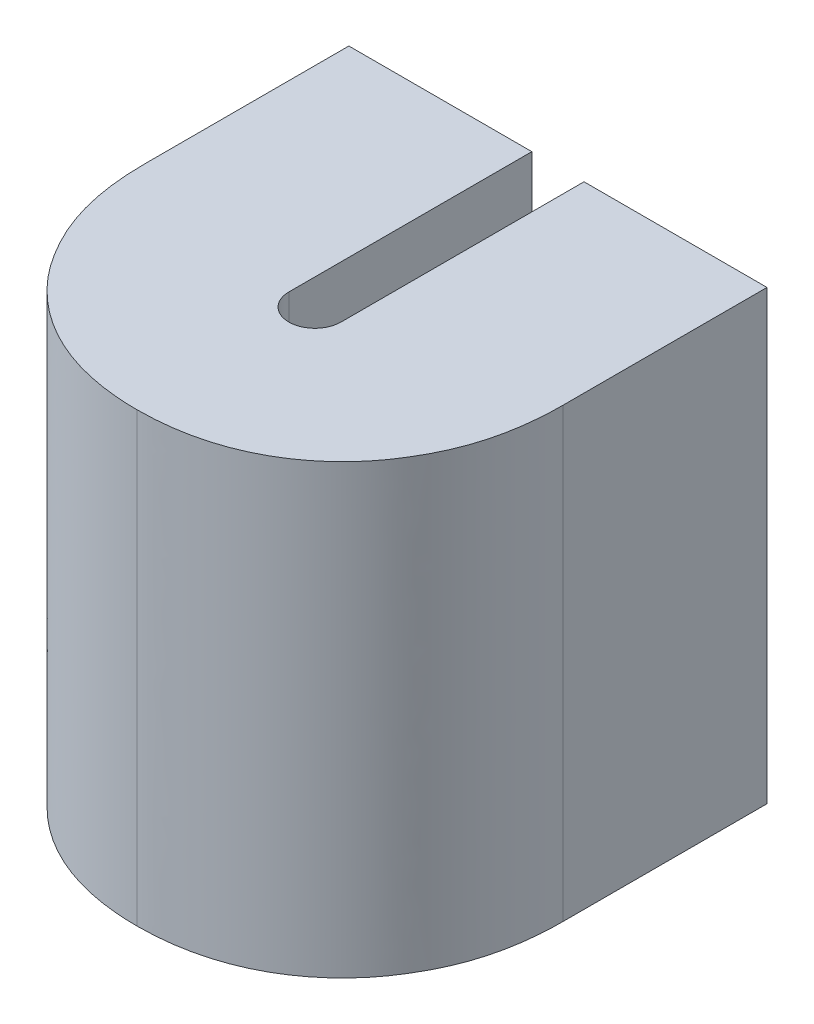
from build123d import *

# Parameters (mm, degrees)
BOSS_EXTRUDE1_DEPTH = 1500


with BuildPart() as part:
    # Sketch1 → Boss-Extrude1 (new body)
    with BuildSketch(Plane(origin=(0, 0, 0), x_dir=(1, 0, 0), z_dir=(0, 1, 0))):
        with BuildLine():
            Line((701.336933058, 727.73340936), (701.336933058, 1412))
            Line((701.336933058, 1412), (87.5, 1412))
            Line((87.5, 1412), (87.5, 596.839793384))
            ThreePointArc((87.5, 596.839793384), (0, 509.339793384), (-87.5, 596.839793384))
            Line((-87.5, 596.839793384), (-87.5, 1412))
            Line((-87.5, 1412), (-701.336933058, 1412))
            Line((-701.336933058, 1412), (-701.336933058, 727.73340936))
            add(Edge.make_bspline(
                [(-701.336933058, 727.73340936), (-701.336933058, 516.521967782), (-626.802318268, 362.488301594), (-504.735344158, 189.729761618), (-300.828052658, 0), (0, 0)],
                knots=[0, 0, 0, 0, 0.501134505, 0.601134505, 1, 1, 1, 1], degree=3))
            add(Edge.make_bspline(
                [(701.336933058, 727.73340936), (701.336933058, 516.521967782), (626.802318268, 362.488301594), (504.735344158, 189.729761618), (300.828052658, 0), (0, 0)],
                knots=[0, 0, 0, 0, 0.501134505, 0.601134505, 1, 1, 1, 1], degree=3))
        make_face()
    extrude(amount=BOSS_EXTRUDE1_DEPTH)


solid = part.part
